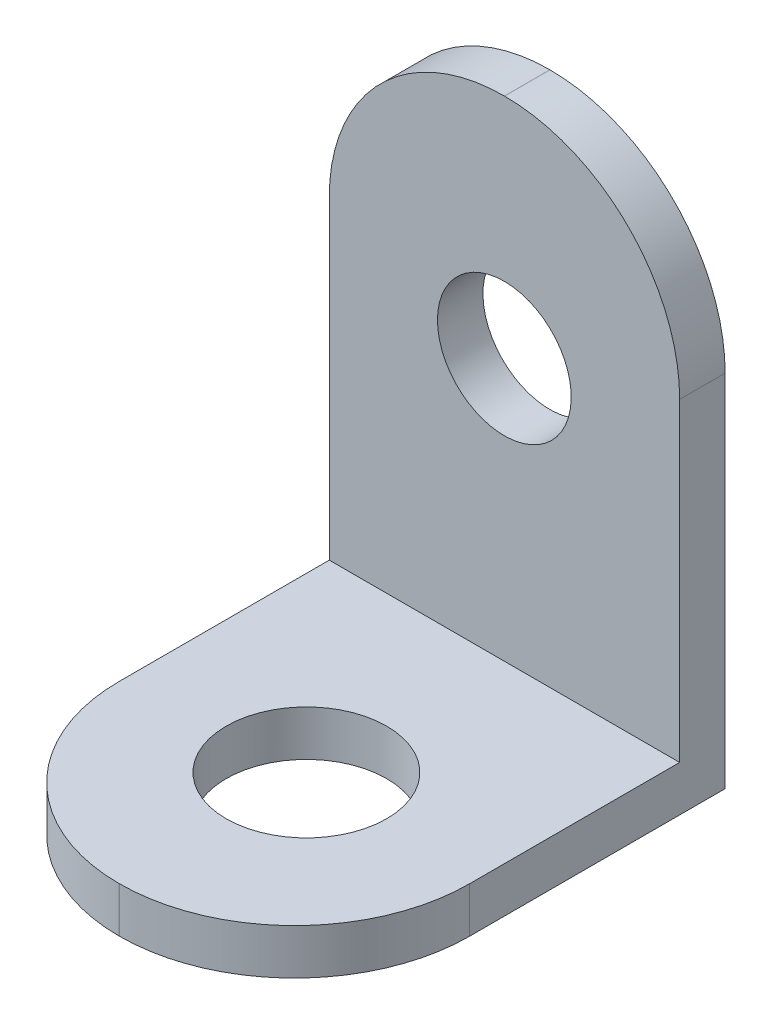
from build123d import *

# Parameters (mm, degrees)
SKETCH1_W           = 16.1
SKETCH1_H           = 20
BOSS_EXTRUDE1_DEPTH = 13.1
SKETCH2_W           = 14.4
SKETCH2_H           = 18.3
CUT_EXTRUDE1_DEPTH  = 26.915439414
FILLET1_R           = 6.545
SKETCH20_R          = 3
CUT_EXTRUDE2_DEPTH  = 10
SKETCH21_R          = 2.5
CUT_EXTRUDE3_DEPTH  = 10


with BuildPart() as part:
    # Sketch1 → Boss-Extrude1 (new body)
    with BuildSketch(Plane(origin=(6.653968254, 0, 0), x_dir=(0, 0, -1), z_dir=(1, 0, 0))):
        with Locations((1.95, 10)):
            Rectangle(SKETCH1_W, SKETCH1_H)
    extrude(amount=-BOSS_EXTRUDE1_DEPTH)

    # Sketch2 → Cut-Extrude1 (cut, through all)
    with BuildSketch(Plane.ZY.offset(6.446031746)):
        with Locations((-1.1, 10.85)):
            Rectangle(SKETCH2_W, SKETCH2_H)
    extrude(amount=-CUT_EXTRUDE1_DEPTH, mode=Mode.SUBTRACT)

    # Fillet1
    fillet1_edges = [part.edges().sort_by_distance(p)[0] for p in [
        (-6.446031746, 20, -9.15),
        (6.653968254, 0.85, 6.1),
        (-6.446031746, 0.85, 6.1),
        (6.653968254, 20, -9.15),
    ]]
    fillet(fillet1_edges, radius=FILLET1_R)

    # Sketch20 → Cut-Extrude2 (cut)
    with BuildSketch(Plane.XZ):
        with Locations(Location((0, -1, 0), (0, 0, 270))):
            Circle(SKETCH20_R)
    extrude(amount=-CUT_EXTRUDE2_DEPTH, mode=Mode.SUBTRACT)

    # Sketch21 → Cut-Extrude3 (cut)
    with BuildSketch(Plane(origin=(0, 0, -10), x_dir=(-1, 0, 0), z_dir=(0, 0, -1))):
        with Locations(Location((-0.098968254, 11.5, 0), (0, 0, 90))):
            Circle(SKETCH21_R)
    extrude(amount=-CUT_EXTRUDE3_DEPTH, mode=Mode.SUBTRACT)


solid = part.part
